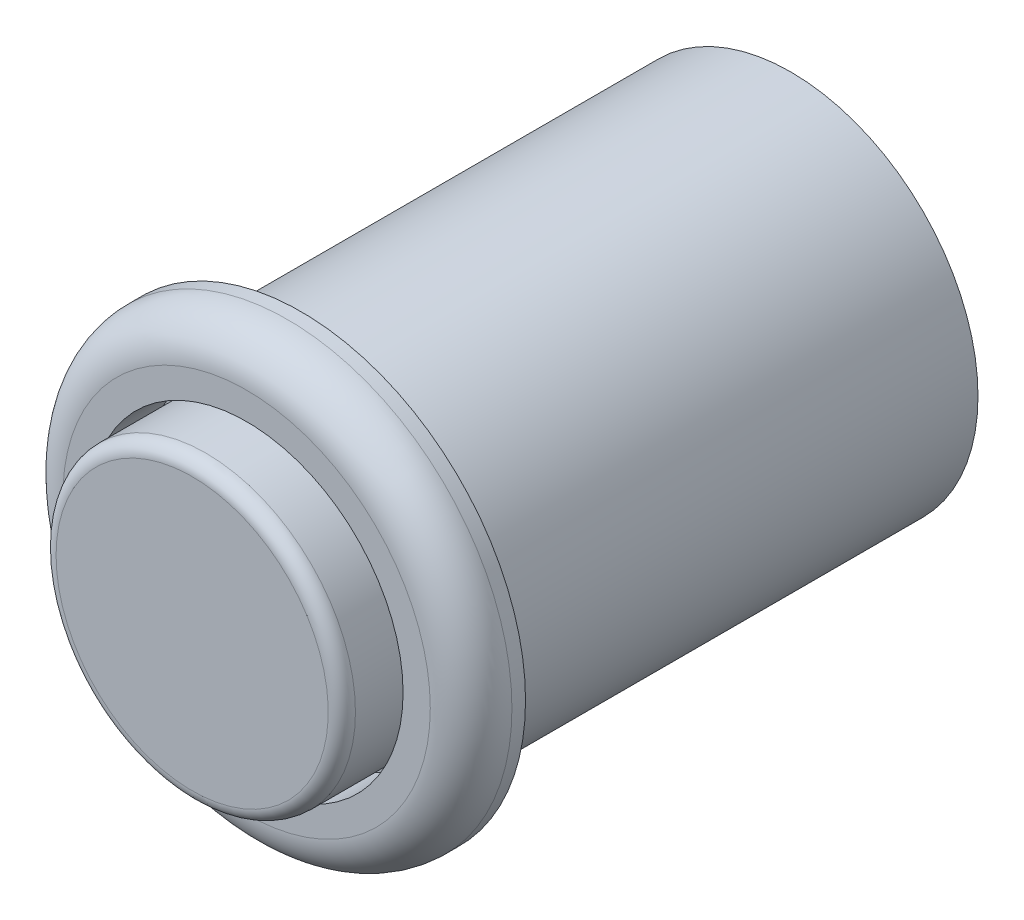
from build123d import *

# Parameters (mm, degrees)
ESQUISSE1_R        = 16.5
ESQUISSE1_R_2      = 11.5
BOSS_EXTRU_1_DEPTH = 4
CONG_1_R           = 3
ESQUISSE2_R        = 11
BOSS_EXTRU_2_DEPTH = 8
CONG_2_R           = 1
ESQUISSE3_R        = 13.75
BOSS_EXTRU_3_DEPTH = 36


with BuildPart() as part:
    # Esquisse1 → Boss.-Extru.1 (new body)
    with BuildSketch(Plane.XY):
        Circle(ESQUISSE1_R)
        Circle(ESQUISSE1_R_2, mode=Mode.SUBTRACT)
    extrude(amount=BOSS_EXTRU_1_DEPTH)

    # Congé1
    cong_1_edges = [part.edges().sort_by_distance(p)[0] for p in [
        (-16.5, 0, 4),
    ]]
    fillet(cong_1_edges, radius=CONG_1_R)



with BuildPart() as body_2:
    # Esquisse2 → Boss.-Extru.2 (new body)
    with BuildSketch(Plane(origin=(0, 0, 0), x_dir=(-1, 0, 0), z_dir=(0, 0, -1))):
        Circle(ESQUISSE2_R)
    extrude(amount=-BOSS_EXTRU_2_DEPTH)

    # Congé2
    cong_2_edges = [body_2.edges().sort_by_distance(p)[0] for p in [
        (11, 0, 8),
    ]]
    fillet(cong_2_edges, radius=CONG_2_R)


with BuildPart() as part_1:
    add(part.part)

    add(body_2.part)  # Boss.-Extru.3 merges body 2
    # Esquisse3 → Boss.-Extru.3 (add)
    with BuildSketch(Plane(origin=(0, 0, 0), x_dir=(-1, 0, 0), z_dir=(0, 0, -1))):
        with Locations(Location((0, 0, 0), (0, 0, 180))):
            Circle(ESQUISSE3_R)
    extrude(amount=BOSS_EXTRU_3_DEPTH)


solid = part_1.part
